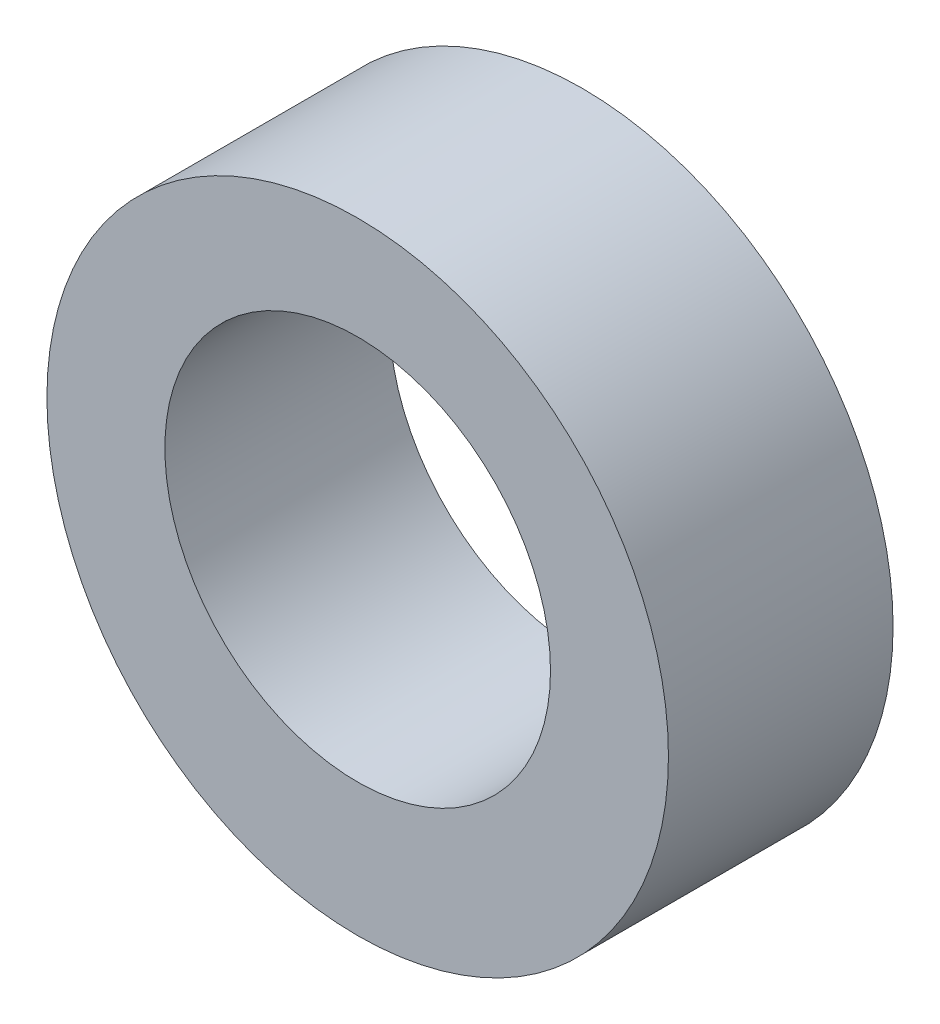
from build123d import *

# Parameters (mm, degrees)
SKETCH1_R           = 69.174019301
BOSS_EXTRUDE1_DEPTH = 50
SKETCH4_R           = 42.918327484
CUT_EXTRUDE1_DEPTH  = 50


with BuildPart() as part:
    # Sketch1 → Boss-Extrude1 (new body)
    with BuildSketch(Plane.XY):
        with Locations((0, 14.936813368)):
            Circle(SKETCH1_R)
    extrude(amount=BOSS_EXTRUDE1_DEPTH)

    # Sketch4 → Cut-Extrude1 (cut)
    with BuildSketch(Plane.XY.offset(50)):
        with Locations((0, 18.287553792)):
            Circle(SKETCH4_R)
    extrude(amount=-CUT_EXTRUDE1_DEPTH, mode=Mode.SUBTRACT)


solid = part.part
